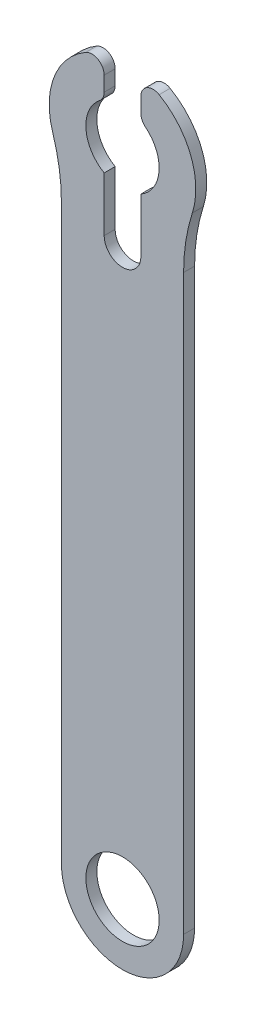
from build123d import *

# Parameters (mm, degrees)
ESQUISSE1_R        = 3
BOSS_EXTRU_1_DEPTH = 0.9
CONG_1_R           = 15
CONG_2_R           = 1


with BuildPart() as part:
    # Esquisse1 → Boss.-Extru.1 (new body)
    with BuildSketch(Plane.XY):
        with BuildLine():
            Line((-1.5, 2.598076211), (-1.5, 5.809475019))
            ThreePointArc((-1.5, 5.809475019), (-5.602135703, 2.148505426), (-5, -3.31662479))
            Line((-5, -3.31662479), (-5, -53.31662479))
            ThreePointArc((-5, -53.31662479), (0, -58.31662479), (5, -53.31662479))
            Line((5, -53.31662479), (5, -3.31662479))
            ThreePointArc((5, -3.31662479), (5.602135703, 2.148505426), (1.5, 5.809475019))
            Line((1.5, 5.809475019), (1.5, 2.598076211))
            ThreePointArc((1.5, 2.598076211), (3, 0), (1.5, -2.598076211))
            Line((1.5, -2.598076211), (1.5, -7.04210447))
            ThreePointArc((1.5, -7.04210447), (0, -8.54210447), (-1.5, -7.04210447))
            Line((-1.5, -7.04210447), (-1.5, -2.598076211))
            ThreePointArc((-1.5, -2.598076211), (-3, 0), (-1.5, 2.598076211))
        make_face()
        with Locations((0, -53.31662479)):
            Circle(ESQUISSE1_R, mode=Mode.SUBTRACT)
    extrude(amount=BOSS_EXTRU_1_DEPTH)

    # Congé1
    cong_1_edges = [part.edges().sort_by_distance(p)[0] for p in [
        (5, -3.31662479, 0.45),
        (-5, -3.31662479, 0.45),
    ]]
    fillet(cong_1_edges, radius=CONG_1_R)

    # Congé2
    cong_2_edges = [part.edges().sort_by_distance(p)[0] for p in [
        (1.5, 2.598076211, 0.45),
        (1.5, 5.809475019, 0.45),
        (-1.5, 5.809475019, 0.45),
        (-1.5, 2.598076211, 0.45),
    ]]
    fillet(cong_2_edges, radius=CONG_2_R)


solid = part.part
